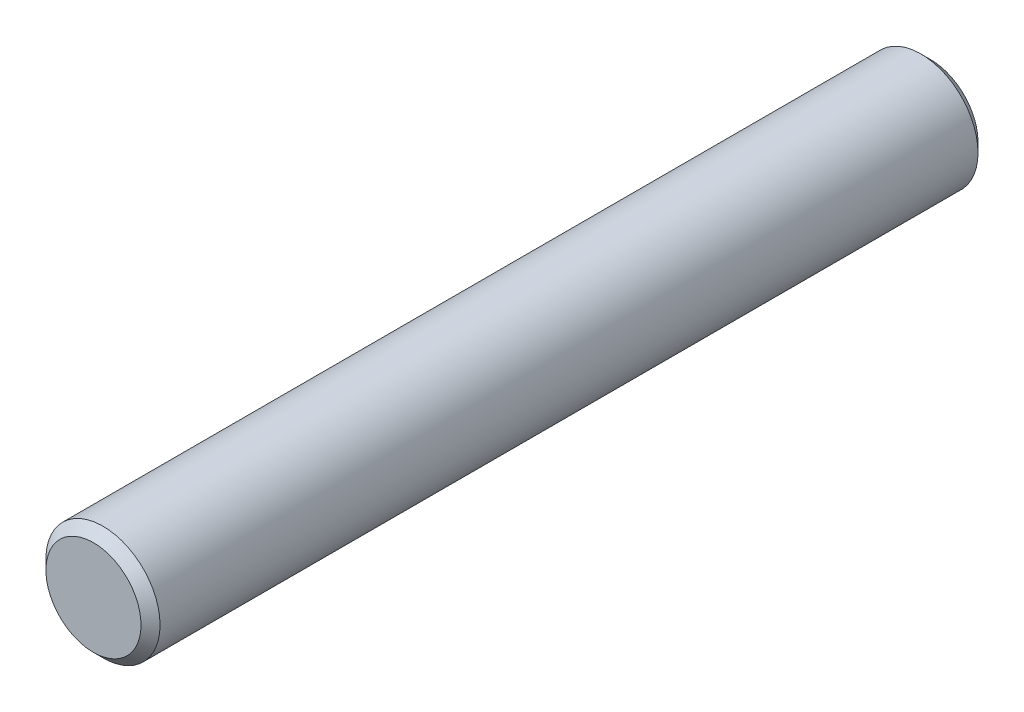
from build123d import *

# Parameters (mm, degrees)
SKETCH1_R           = 3
BOSS_EXTRUDE1_DEPTH = 44
CHAMFER1_SIZE       = 0.5


with BuildPart() as part:
    # Sketch1 → Boss-Extrude1 (new body)
    with BuildSketch(Plane.XY):
        Circle(SKETCH1_R)
    extrude(amount=BOSS_EXTRUDE1_DEPTH)

    # Chamfer1
    chamfer1_edges = [part.edges().sort_by_distance(p)[0] for p in [
        (-3, 0, 0),
        (-3, 0, 44),
    ]]
    chamfer(chamfer1_edges, length=CHAMFER1_SIZE)


solid = part.part
